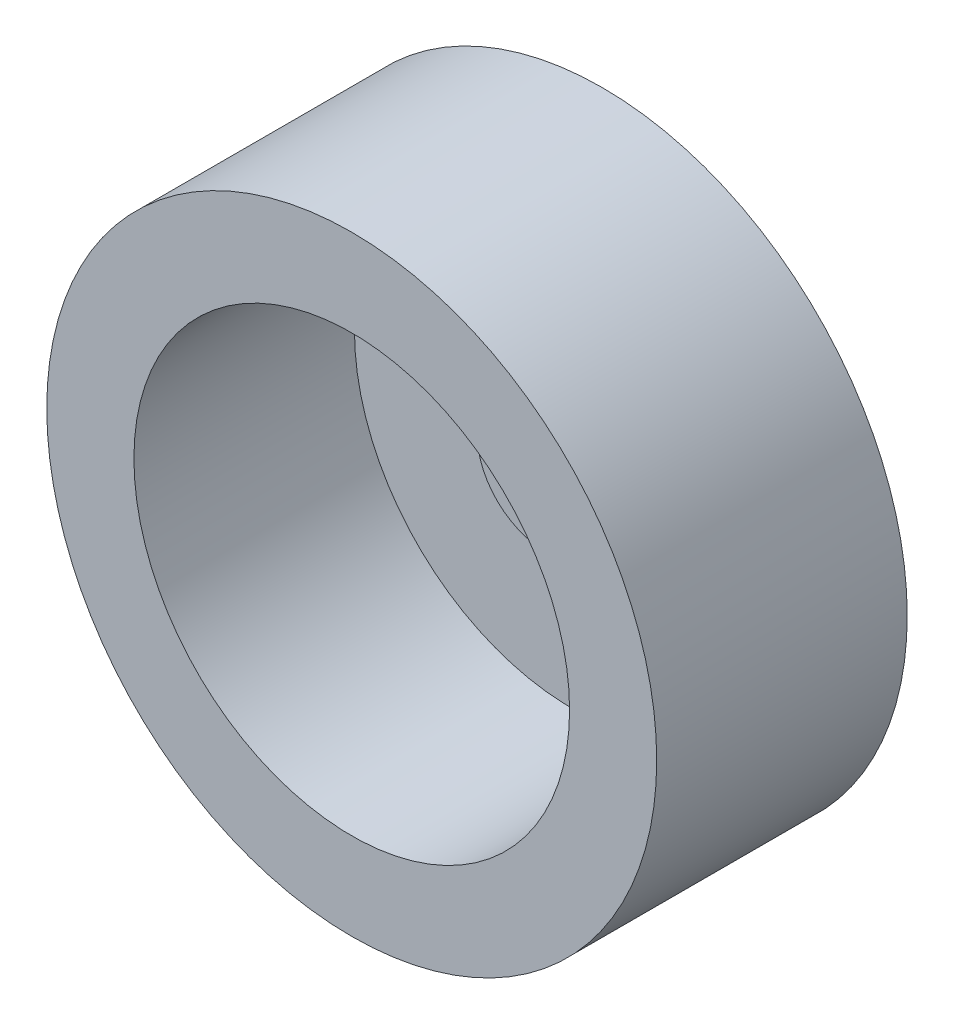
from build123d import *

# Parameters (mm, degrees)
CROQUIS1_R              = 56
SALIENTE_EXTRUIR1_DEPTH = 23
CROQUIS2_R              = 40
CORTAR_EXTRUIR1_DEPTH   = 40.5
CROQUIS3_R              = 12.5
SALIENTE_EXTRUIR2_DEPTH = 5
CORTAR_EXTRUIR2_DEPTH   = 5
CROQUIS5_R              = 6
CORTAR_EXTRUIR3_DEPTH   = 89.950829114
CROQUIS6_R              = 12.5
CORTAR_EXTRUIR4_DEPTH   = 3


with BuildPart() as part:
    # Croquis1 → Saliente-Extruir1 (new, symmetric)
    with BuildSketch(Plane.XY):
        Circle(CROQUIS1_R)
    extrude(amount=SALIENTE_EXTRUIR1_DEPTH, both=True)

    # Croquis2 → Cortar-Extruir1 (cut)
    with BuildSketch(Plane.XY.offset(23)):
        Circle(CROQUIS2_R)
    extrude(amount=-CORTAR_EXTRUIR1_DEPTH, mode=Mode.SUBTRACT)

    # Croquis3 → Saliente-Extruir2 (add)
    with BuildSketch(Plane.XY.offset(-17.5)):
        Circle(CROQUIS3_R)
    extrude(amount=SALIENTE_EXTRUIR2_DEPTH)

    # Croquis4 → Cortar-Extruir2 (cut)
    with BuildSketch(Plane.XY.offset(-12.5)):
        Polygon((0, 9.814954576), (-8.5, 4.907477288), (-8.5, -4.907477288), (0, -9.814954576), (8.5, -4.907477288), (8.5, 4.907477288), align=None)
    extrude(amount=-CORTAR_EXTRUIR2_DEPTH, mode=Mode.SUBTRACT)

    # Croquis5 → Cortar-Extruir3 (cut, through all)
    with BuildSketch(Plane.XY.offset(-17.5)):
        Circle(CROQUIS5_R)
    extrude(amount=-CORTAR_EXTRUIR3_DEPTH, mode=Mode.SUBTRACT)

    # Croquis6 → Cortar-Extruir4 (cut)
    with BuildSketch(Plane(origin=(0, 0, -23), x_dir=(-1, 0, 0), z_dir=(0, 0, -1))):
        Circle(CROQUIS6_R)
    extrude(amount=-CORTAR_EXTRUIR4_DEPTH, mode=Mode.SUBTRACT)


solid = part.part
